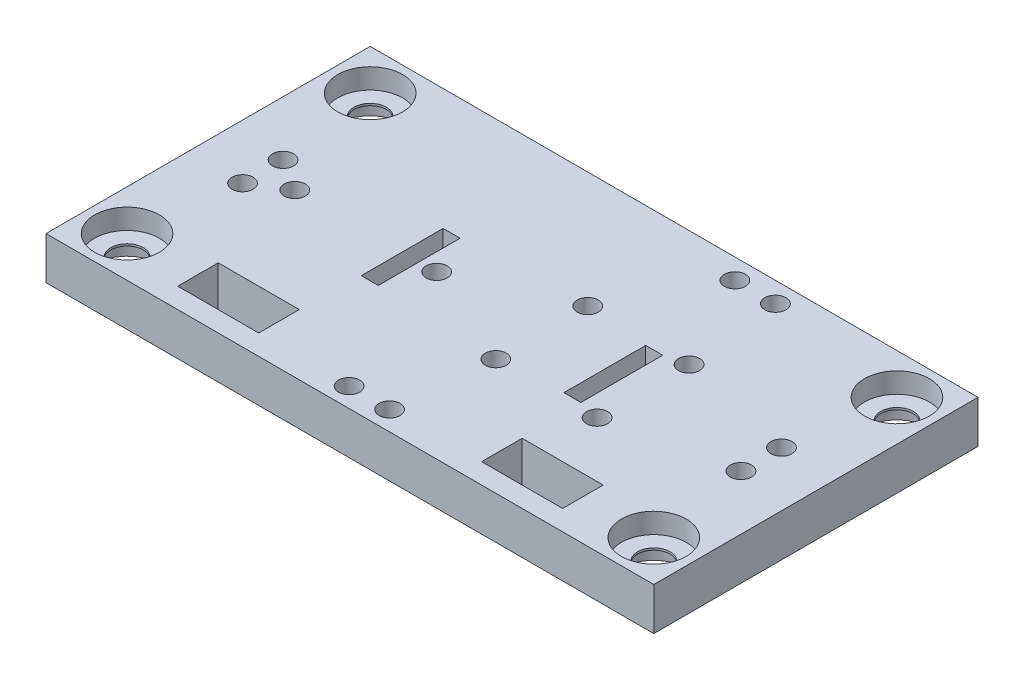
from build123d import *

# Parameters (mm, degrees)
SKETCH1_W            = 150
SKETCH1_H            = 80
BOSS_EXTRUDE1_DEPTH  = 10.5
SKETCH10_R           = 8
CUT_EXTRUDE8_DEPTH   = 5
WIREHOLES_REACH      = 172.324
SKETCH3_W            = 20
SKETCH3_H            = 10
SKETCH6_R            = 2.6
F_4AACUT_DEPTH       = 5.2
SKETCH7_R            = 2.6
F_2AACUT_DEPTH       = 5.2
SKETCH5_W            = 4.2
SKETCH5_H            = 20.2
ARDUINOMEGACUT_DEPTH = 5.2
SKETCH8_R            = 2.6
MPUCUT_DEPTH         = 5.2
CUT_EXTRUDE7_REACH   = 172.324
SKETCH9_R            = 2.6
SKETCH11_R           = 4
CUT_EXTRUDE9_DEPTH   = 0.5
SKETCH12_R           = 2.6
CUT_EXTRUDE10_DEPTH  = 5


with BuildPart() as part:
    # Sketch1 → Boss-Extrude1 (new body)
    with BuildSketch(Plane(origin=(0, 0, 0), x_dir=(1, 0, 0), z_dir=(0, 1, 0))):
        with Locations((75, 40)):
            Rectangle(SKETCH1_W, SKETCH1_H)
    extrude(amount=BOSS_EXTRUDE1_DEPTH)

    # Sketch10 → Cut-Extrude8 (cut)
    with BuildSketch(Plane(origin=(0, 10.5, 0), x_dir=(1, 0, 0), z_dir=(0, 1, 0))):
        with Locations(Location((10, 10, 0), (0, 0, 270))):
            Circle(SKETCH10_R)
        with Locations(Location((140, 10, 0), (0, 0, 270))):
            Circle(SKETCH10_R)
        with Locations(Location((10, 70, 0), (0, 0, 270))):
            Circle(SKETCH10_R)
        with Locations(Location((140, 70, 0), (0, 0, 270))):
            Circle(SKETCH10_R)
    cut_extrude8 = extrude(amount=-CUT_EXTRUDE8_DEPTH, mode=Mode.SUBTRACT)

    # Mirror1: Cut-Extrude8 across plane
    add(cut_extrude8.mirror(Plane.ZX.offset(5.25)), mode=Mode.SUBTRACT)

    # Sketch3 → WireHoles (cut, up to next)
    with BuildSketch(Plane(origin=(0, 10.5, 0), x_dir=(1, 0, 0), z_dir=(0, 1, 0)), mode=Mode.PRIVATE) as wireholes_sk1:
        with Locations((37.5, 10)):
            Rectangle(SKETCH3_W, SKETCH3_H)
    wireholes_tool1 = extrude(wireholes_sk1.sketch, amount=-WIREHOLES_REACH, mode=Mode.PRIVATE) & part.part
    # Sketch3 → WireHoles (cut, up to next)
    with BuildSketch(Plane(origin=(0, 10.5, 0), x_dir=(1, 0, 0), z_dir=(0, 1, 0)), mode=Mode.PRIVATE) as wireholes_sk2:
        with Locations((112.5, 10)):
            Rectangle(SKETCH3_W, SKETCH3_H)
    wireholes_tool2 = extrude(wireholes_sk2.sketch, amount=-WIREHOLES_REACH, mode=Mode.PRIVATE) & part.part
    add(wireholes_tool1.solids().sort_by_distance((37.5, 10.5, -10))[0], mode=Mode.SUBTRACT)
    add(wireholes_tool2.solids().sort_by_distance((112.5, 10.5, -10))[0], mode=Mode.SUBTRACT)

    # Sketch6 → 4AACut (cut)
    with BuildSketch(Plane(origin=(0, 10.5, 0), x_dir=(1, 0, 0), z_dir=(0, 1, 0))):
        with Locations(Location((21.4, 40, 0), (0, 0, 270))):
            Circle(SKETCH6_R)
        with Locations(Location((56.4, 40, 0), (0, 0, 90))):
            Circle(SKETCH6_R)
    extrude(amount=-F_4AACUT_DEPTH, mode=Mode.SUBTRACT)

    # Sketch7 → 2AACut (cut)
    with BuildSketch(Plane(origin=(0, 10.5, 0), x_dir=(1, 0, 0), z_dir=(0, 1, 0))):
        with Locations(Location((82.35, 51.35, 0), (0, 0, 270))):
            Circle(SKETCH7_R)
        with Locations(Location((107.35, 51.35, 0), (0, 0, 90))):
            Circle(SKETCH7_R)
        with Locations(Location((82.35, 28.65, 0), (0, 0, 90))):
            Circle(SKETCH7_R)
        with Locations(Location((107.35, 28.65, 0), (0, 0, 270))):
            Circle(SKETCH7_R)
    extrude(amount=-F_2AACUT_DEPTH, mode=Mode.SUBTRACT)

    # Sketch5 → ArduinoMegaCut (cut)
    with BuildSketch(Plane(origin=(0, 10.5, 0), x_dir=(1, 0, 0), z_dir=(0, 1, 0))):
        with Locations((50, 40)):
            Rectangle(SKETCH5_W, SKETCH5_H)
        with Locations((100, 40)):
            Rectangle(SKETCH5_W, SKETCH5_H)
    extrude(amount=-ARDUINOMEGACUT_DEPTH, mode=Mode.SUBTRACT)

    # Sketch8 → MPUCut (cut)
    with BuildSketch(Plane(origin=(0, 10.5, 0), x_dir=(1, 0, 0), z_dir=(0, 1, 0))):
        with Locations(Location((70, 4.8, 0), (0, 0, 270))):
            Circle(SKETCH8_R)
        with Locations(Location((80, 4.8, 0), (0, 0, 90))):
            Circle(SKETCH8_R)
    extrude(amount=-MPUCUT_DEPTH, mode=Mode.SUBTRACT)

    # Sketch9 → Cut-Extrude7 (cut, up to next)
    with BuildSketch(Plane(origin=(0, 10.5, 0), x_dir=(1, 0, 0), z_dir=(0, 1, 0)), mode=Mode.PRIVATE) as cut_extrude7_sk1:
        with Locations(Location((136.5, 45, 0), (0, 0, 270))):
            Circle(SKETCH9_R)
    cut_extrude7_tool1 = extrude(cut_extrude7_sk1.sketch, amount=-CUT_EXTRUDE7_REACH, mode=Mode.PRIVATE) & part.part
    # Sketch9 → Cut-Extrude7 (cut, up to next)
    with BuildSketch(Plane(origin=(0, 10.5, 0), x_dir=(1, 0, 0), z_dir=(0, 1, 0)), mode=Mode.PRIVATE) as cut_extrude7_sk2:
        with Locations(Location((136.5, 35, 0), (0, 0, 270))):
            Circle(SKETCH9_R)
    cut_extrude7_tool2 = extrude(cut_extrude7_sk2.sketch, amount=-CUT_EXTRUDE7_REACH, mode=Mode.PRIVATE) & part.part
    # Sketch9 → Cut-Extrude7 (cut, up to next)
    with BuildSketch(Plane(origin=(0, 10.5, 0), x_dir=(1, 0, 0), z_dir=(0, 1, 0)), mode=Mode.PRIVATE) as cut_extrude7_sk3:
        with Locations(Location((13.5, 45, 0), (0, 0, 270))):
            Circle(SKETCH9_R)
    cut_extrude7_tool3 = extrude(cut_extrude7_sk3.sketch, amount=-CUT_EXTRUDE7_REACH, mode=Mode.PRIVATE) & part.part
    # Sketch9 → Cut-Extrude7 (cut, up to next)
    with BuildSketch(Plane(origin=(0, 10.5, 0), x_dir=(1, 0, 0), z_dir=(0, 1, 0)), mode=Mode.PRIVATE) as cut_extrude7_sk4:
        with Locations(Location((13.5, 35, 0), (0, 0, 270))):
            Circle(SKETCH9_R)
    cut_extrude7_tool4 = extrude(cut_extrude7_sk4.sketch, amount=-CUT_EXTRUDE7_REACH, mode=Mode.PRIVATE) & part.part
    add(cut_extrude7_tool1.solids().sort_by_distance((136.5, 10.5, -45))[0], mode=Mode.SUBTRACT)
    add(cut_extrude7_tool2.solids().sort_by_distance((136.5, 10.5, -35))[0], mode=Mode.SUBTRACT)
    add(cut_extrude7_tool3.solids().sort_by_distance((13.5, 10.5, -45))[0], mode=Mode.SUBTRACT)
    add(cut_extrude7_tool4.solids().sort_by_distance((13.5, 10.5, -35))[0], mode=Mode.SUBTRACT)

    # Sketch11 → Cut-Extrude9 (cut)
    with BuildSketch(Plane(origin=(0, 5.5, 0), x_dir=(1, 0, 0), z_dir=(0, 1, 0))):
        with Locations(Location((10, 10, 0), (0, 0, 270))):
            Circle(SKETCH11_R)
        with Locations(Location((10, 70, 0), (0, 0, 90))):
            Circle(SKETCH11_R)
        with Locations(Location((140, 70, 0), (0, 0, 270))):
            Circle(SKETCH11_R)
        with Locations(Location((140, 10, 0), (0, 0, 90))):
            Circle(SKETCH11_R)
    extrude(amount=-CUT_EXTRUDE9_DEPTH, mode=Mode.SUBTRACT)

    # Sketch12 → Cut-Extrude10 (cut)
    with BuildSketch(Plane(origin=(0, 10.5, 0), x_dir=(1, 0, 0), z_dir=(0, 1, 0))):
        with Locations(Location((95, 75, 0), (0, 0, 270))):
            Circle(SKETCH12_R)
        with Locations(Location((105, 75, 0), (0, 0, 90))):
            Circle(SKETCH12_R)
    extrude(amount=-CUT_EXTRUDE10_DEPTH, mode=Mode.SUBTRACT)


solid = part.part
